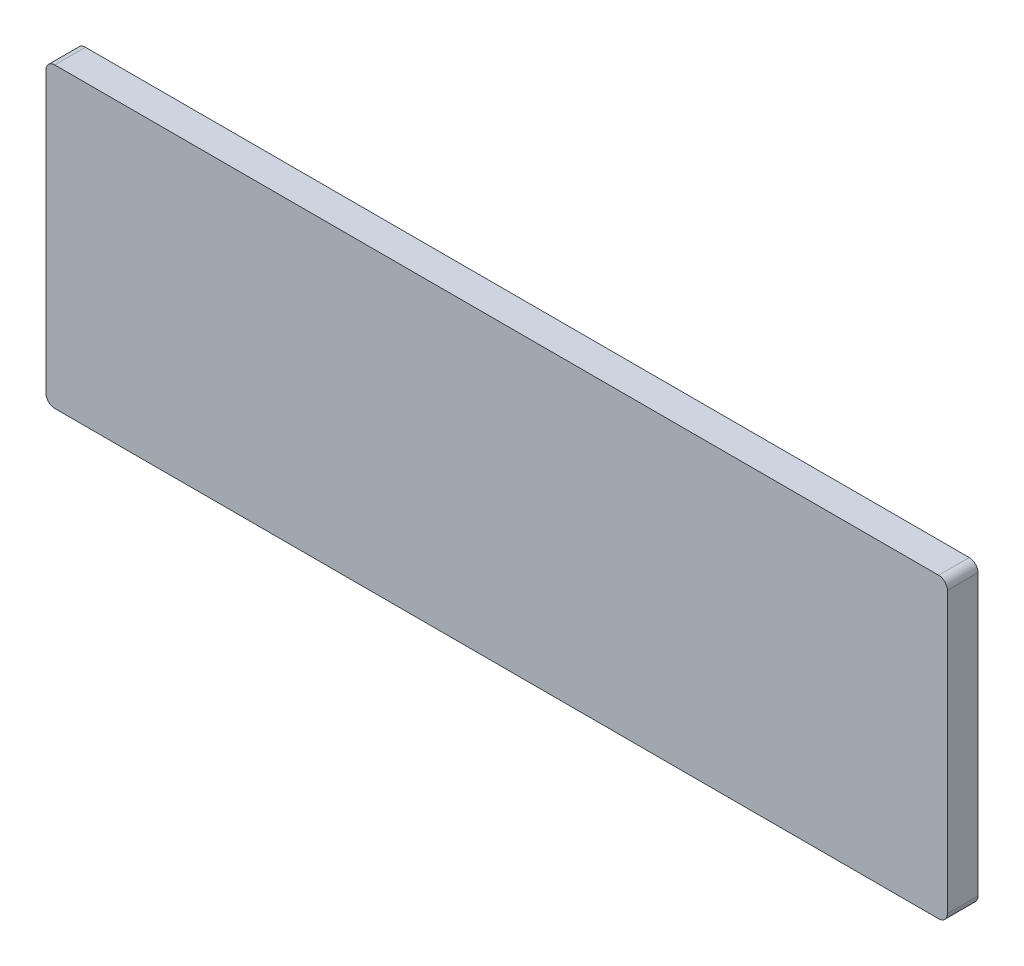
from build123d import *

# Parameters (mm, degrees)
EXTRUDE_1_DEPTH = 7


with BuildPart() as part:
    # 草图1 → 凸台-拉伸1 (new body)
    with BuildSketch(Plane.XY):
        with BuildLine():
            Line((-101, 34), (101, 34))
            ThreePointArc((101, 34), (102.414213562, 33.414213562), (103, 32))
            Line((103, 32), (103, -32))
            ThreePointArc((103, -32), (102.414213562, -33.414213562), (101, -34))
            Line((101, -34), (-101, -34))
            ThreePointArc((-101, -34), (-102.414213562, -33.414213562), (-103, -32))
            Line((-103, -32), (-103, 32))
            ThreePointArc((-103, 32), (-102.414213562, 33.414213562), (-101, 34))
        make_face()
    extrude(amount=EXTRUDE_1_DEPTH)


solid = part.part
